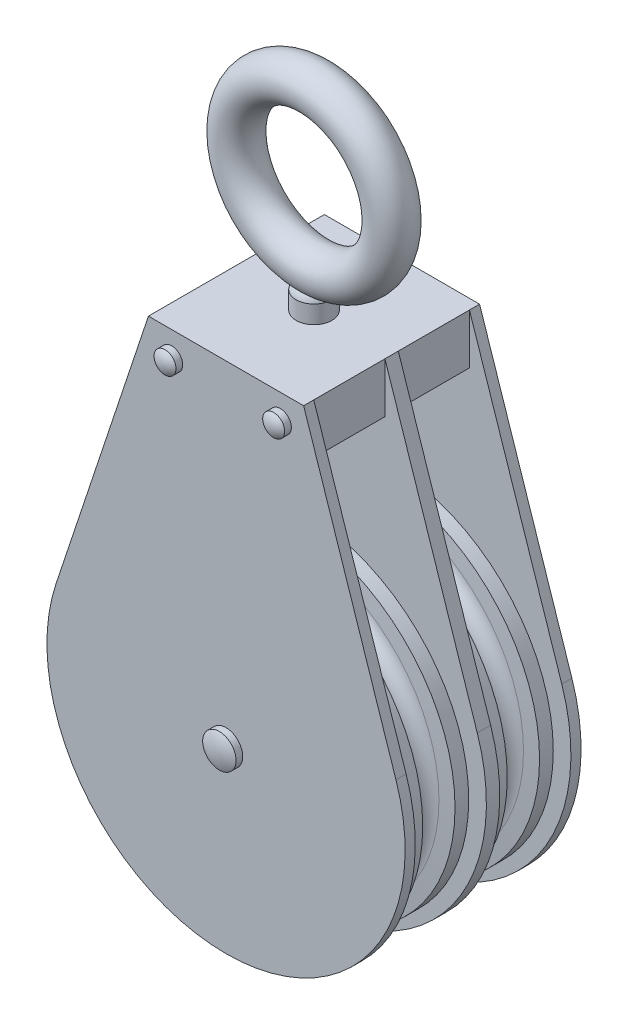
from build123d import *

# Parameters (mm, degrees)
BOSS_EXTRUDE1_DEPTH   = 2.6924
SKETCH5_W             = 41.275
SKETCH5_H             = 13.335
BOSS_EXTRUDE2_DEPTH   = 9.4615
SKETCH10_R            = 5.55625
SKETCH6_R             = 4.445
SKETCH6_R_2           = 2.921
BOSS_EXTRUDE3_DEPTH   = 1.778
DOME1_FACE_RADIUS     = 2.921
DOME1_HEIGHT          = 1.016
DOME3_FACE_RADIUS     = 2.921
DOME3_HEIGHT          = 1.016
DOME8_FACE_RADIUS     = 4.445
DOME8_HEIGHT          = 1.016
SKETCH8_R             = 4.191
BOSS_EXTRUDE4_DEPTH   = 1.778
BOSS_EXTRUDE4_2_DEPTH = 1.778
SKETCH8_R_2           = 6.35
BOSS_EXTRUDE4_3_DEPTH = 1.778
DOME5_FACE_RADIUS     = 4.191
DOME5_HEIGHT          = 2.54
DOME6_FACE_RADIUS     = 4.191
DOME6_HEIGHT          = 2.54
DOME7_FACE_RADIUS     = 6.35
DOME7_HEIGHT          = 3.9624
BOSS_EXTRUDE5_REACH   = 164.351
SKETCH9_R             = 3.57505
SKETCH15_R            = 4.7625
BOSS_EXTRUDE6_DEPTH   = 4.064
FILLET1_R             = 2.032


with BuildPart() as part:
    # Sketch3 → Revolve1 (revolve)
    with BuildSketch(Plane(origin=(0, 0, 0), x_dir=(0, 0, -1), z_dir=(1, 0, 0)), mode=Mode.PRIVATE) as revolve1_sk:
        with BuildLine():
            Line((-7.9375, 44.45), (-7.9375, 0))
            Line((-7.9375, 0), (7.9375, 0))
            Line((7.9375, 0), (7.9375, 44.45))
            Line((7.9375, 44.45), (4.297797433, 44.45))
            Line((4.297797433, 44.45), (3.953647708, 40.516350646))
            ThreePointArc((3.953647708, 40.516350646), (0, 36.8935), (-3.953647708, 40.516350646))
            Line((-3.953647708, 40.516350646), (-4.297797433, 44.45))
            Line((-4.297797433, 44.45), (-7.9375, 44.45))
        make_face()
    revolve(revolve1_sk.sketch.rotate(Axis((0, 0, 7.9375), (0, 0, -1)), 90), axis=Axis((0, 0, 7.9375), (0, 0, -1)))


with BuildPart() as body_2:
    # Sketch4 → Boss-Extrude1 (new body)
    with BuildSketch(Plane.XY.offset(9.4615)):
        with BuildLine():
            Line((-20.6375, 88.9), (20.6375, 88.9))
            Line((20.6375, 88.9), (45.193815989, 15.021971288))
            ThreePointArc((45.193815989, 15.021971288), (0, -47.625), (-45.193815989, 15.021971288))
            Line((-45.193815989, 15.021971288), (-20.6375, 88.9))
        make_face()
    extrude(amount=BOSS_EXTRUDE1_DEPTH)

    # Sketch5 → Boss-Extrude2 (add)
    with BuildSketch(Plane(origin=(0, 0, 9.4615), x_dir=(-1, 0, 0), z_dir=(0, 0, -1))):
        with Locations((0, 82.2325)):
            Rectangle(SKETCH5_W, SKETCH5_H)
    extrude(amount=BOSS_EXTRUDE2_DEPTH)

    # Mirror1: body 2 across plane


with BuildPart() as body_2_1:
    add(body_2.part)
    add(body_2.part.mirror(Plane.XY))


with BuildPart() as body_3:
    # Mirror8: mirrored copy
    add(part.part.mirror(Plane(origin=(0, 0, -11.2395), x_dir=(1, 0, 0), z_dir=(0, 0, -1))))


with BuildPart() as body_4:
    # Mirror8 2: mirrored copy
    add(body_2_1.part.mirror(Plane(origin=(0, 0, -11.2395), x_dir=(1, 0, 0), z_dir=(0, 0, -1))))


with BuildPart() as body_5:
    # Sweep2: sweep along a path in Sketch11
    with BuildLine(Plane.XY.offset(-11.2395)) as sweep2_path:
        ThreePointArc((20.6375, 119.85625), (0, 140.49375), (-20.6375, 119.85625))
    # Sketch10 → Sweep2 (sweep)
    with BuildSketch(Plane(origin=(0, 119.85625, 0), x_dir=(-1, 0, 0), z_dir=(0, 1, 0))):
        with Locations((-20.6375, -11.2395)):
            Circle(SKETCH10_R)
    sweep(path=sweep2_path.line)

    # Mirror7: body 5 across plane


with BuildPart() as body_5_1:
    add(body_5.part)
    add(body_5.part.mirror(Plane(origin=(20.6375, 119.85625, -11.2395), x_dir=(0, 0, 1), z_dir=(0, 1, 0))))

    # Sketch14 → Revolve2 (revolve)
    with BuildSketch(Plane.XY.offset(-11.2395), mode=Mode.PRIVATE) as revolve2_sk:
        with BuildLine():
            Line((4.7625, 88.9), (4.7625, 93.6625))
            ThreePointArc((4.7625, 93.6625), (3.016714146, 96.331608663), (0, 97.366666667))
            Line((0, 97.366666667), (0, 88.9))
            Line((0, 88.9), (4.7625, 88.9))
        make_face()
    revolve(revolve2_sk.sketch.rotate(Axis((0, 53.18125, -11.2395), (0, 1, 0)), 90), axis=Axis((0, 53.18125, -11.2395), (0, 1, 0)))


with BuildPart() as body_2_2:
    add(body_2_1.part)

    # Sketch6 → Boss-Extrude3 (add)
    with BuildSketch(Plane.XY.offset(12.1539)):
        Circle(SKETCH6_R)
        with Locations((-14.44625, 82.2325)):
            Circle(SKETCH6_R_2)
        with Locations((14.44625, 82.2325)):
            Circle(SKETCH6_R_2)
    extrude(amount=BOSS_EXTRUDE3_DEPTH)

    # Dome1: a dome of height H over a round flat face of radius A is a cap of a sphere of radius (A * A + H * H) / (2 * H)
    dome1_r = (DOME1_FACE_RADIUS * DOME1_FACE_RADIUS + DOME1_HEIGHT * DOME1_HEIGHT) / (2 * DOME1_HEIGHT)
    dome1_base = Plane((-14.44625, 82.2325, 13.9319), z_dir=(0, 0, 1))
    with Locations(dome1_base.offset(DOME1_HEIGHT - dome1_r)):
        dome1_ball = Sphere(dome1_r, mode=Mode.PRIVATE)
    add(split(dome1_ball, bisect_by=dome1_base, keep=Keep.TOP, mode=Mode.PRIVATE))

    # Dome3: a dome of height H over a round flat face of radius A is a cap of a sphere of radius (A * A + H * H) / (2 * H)
    dome3_r = (DOME3_FACE_RADIUS * DOME3_FACE_RADIUS + DOME3_HEIGHT * DOME3_HEIGHT) / (2 * DOME3_HEIGHT)
    dome3_base = Plane((14.44625, 82.2325, 13.9319), z_dir=(0, 0, 1))
    with Locations(dome3_base.offset(DOME3_HEIGHT - dome3_r)):
        dome3_ball = Sphere(dome3_r, mode=Mode.PRIVATE)
    add(split(dome3_ball, bisect_by=dome3_base, keep=Keep.TOP, mode=Mode.PRIVATE))

    # Dome8: a dome of height H over a round flat face of radius A is a cap of a sphere of radius (A * A + H * H) / (2 * H)
    dome8_r = (DOME8_FACE_RADIUS * DOME8_FACE_RADIUS + DOME8_HEIGHT * DOME8_HEIGHT) / (2 * DOME8_HEIGHT)
    dome8_base = Plane((0, 0, 13.9319), z_dir=(0, 0, 1))
    with Locations(dome8_base.offset(DOME8_HEIGHT - dome8_r)):
        dome8_ball = Sphere(dome8_r, mode=Mode.PRIVATE)
    add(split(dome8_ball, bisect_by=dome8_base, keep=Keep.TOP, mode=Mode.PRIVATE))


with BuildPart() as body_6:
    # Sketch8 → Boss-Extrude4 (new body)
    with BuildSketch(Plane(origin=(0, 0, -34.6329), x_dir=(-1, 0, 0), z_dir=(0, 0, -1))):
        with Locations((-14.44625, 82.2325)):
            Circle(SKETCH8_R)
    extrude(amount=BOSS_EXTRUDE4_DEPTH)

    # Dome5: a dome of height H over a round flat face of radius A is a cap of a sphere of radius (A * A + H * H) / (2 * H)
    dome5_r = (DOME5_FACE_RADIUS * DOME5_FACE_RADIUS + DOME5_HEIGHT * DOME5_HEIGHT) / (2 * DOME5_HEIGHT)
    dome5_base = Plane((14.44625, 82.2325, -36.4109), z_dir=(0, 0, -1))
    with Locations(dome5_base.offset(DOME5_HEIGHT - dome5_r)):
        dome5_ball = Sphere(dome5_r, mode=Mode.PRIVATE)
    add(split(dome5_ball, bisect_by=dome5_base, keep=Keep.TOP, mode=Mode.PRIVATE))


with BuildPart() as body_7:
    # Sketch8 → Boss-Extrude4 2 (new body)
    with BuildSketch(Plane(origin=(0, 0, -34.6329), x_dir=(-1, 0, 0), z_dir=(0, 0, -1))):
        with Locations((14.44625, 82.2325)):
            Circle(SKETCH8_R)
    extrude(amount=BOSS_EXTRUDE4_2_DEPTH)

    # Dome6: a dome of height H over a round flat face of radius A is a cap of a sphere of radius (A * A + H * H) / (2 * H)
    dome6_r = (DOME6_FACE_RADIUS * DOME6_FACE_RADIUS + DOME6_HEIGHT * DOME6_HEIGHT) / (2 * DOME6_HEIGHT)
    dome6_base = Plane((-14.44625, 82.2325, -36.4109), z_dir=(0, 0, -1))
    with Locations(dome6_base.offset(DOME6_HEIGHT - dome6_r)):
        dome6_ball = Sphere(dome6_r, mode=Mode.PRIVATE)
    add(split(dome6_ball, bisect_by=dome6_base, keep=Keep.TOP, mode=Mode.PRIVATE))


with BuildPart() as body_8:
    # Sketch8 → Boss-Extrude4 3 (new body)
    with BuildSketch(Plane(origin=(0, 0, -34.6329), x_dir=(-1, 0, 0), z_dir=(0, 0, -1))):
        Circle(SKETCH8_R_2)
    extrude(amount=BOSS_EXTRUDE4_3_DEPTH)

    # Dome7: a dome of height H over a round flat face of radius A is a cap of a sphere of radius (A * A + H * H) / (2 * H)
    dome7_r = (DOME7_FACE_RADIUS * DOME7_FACE_RADIUS + DOME7_HEIGHT * DOME7_HEIGHT) / (2 * DOME7_HEIGHT)
    dome7_base = Plane((0, 0, -36.4109), z_dir=(0, 0, -1))
    with Locations(dome7_base.offset(DOME7_HEIGHT - dome7_r)):
        dome7_ball = Sphere(dome7_r, mode=Mode.PRIVATE)
    add(split(dome7_ball, bisect_by=dome7_base, keep=Keep.TOP, mode=Mode.PRIVATE))


with BuildPart() as part_1:
    add(part.part)

    # Boss-Extrude5: up to this face of the body (flat: up to its plane)
    boss_extrude5_end = Plane(body_4.part.faces().sort_by_distance((0, 17.170238389, -34.6329))[0])
    # Sketch9 → Boss-Extrude5 (add, up to the picked face)
    with BuildSketch(Plane.XY.offset(12.1539), mode=Mode.PRIVATE) as boss_extrude5_sk1:
        Circle(SKETCH9_R)
    boss_extrude5_tool1 = split(extrude(boss_extrude5_sk1.sketch, amount=-BOSS_EXTRUDE5_REACH, mode=Mode.PRIVATE), bisect_by=boss_extrude5_end, keep=Keep.BOTH, mode=Mode.PRIVATE)

    add(body_2_2.part)  # Boss-Extrude5 merges body 2
    add(boss_extrude5_tool1.solids().sort_by(Axis((0, 0, 12.1539), (0, 0, -1)))[0])

    # Combine1: union body 5
    add(body_5_1.part)

    # Sketch15 → Boss-Extrude6 (add)
    with BuildSketch(Plane.XZ.offset(-75.565)):
        with Locations(Location((0, -11.2395, 0), (0, 0, 270))):
            Circle(SKETCH15_R)
    extrude(amount=BOSS_EXTRUDE6_DEPTH)

    # Fillet1
    fillet1_edges = [part_1.edges().sort_by_distance(p)[0] for p in [
        (0, 71.501, -6.477),
        (0, 71.501, -16.002),
    ]]
    fillet(fillet1_edges, radius=FILLET1_R)


with BuildPart() as body_3_1:
    add(body_3.part)

    # Combine2: union body 6, body 4, body 7, part, body 8
    add(body_6.part)
    add(body_4.part)
    add(body_7.part)
    add(part_1.part)
    add(body_8.part)


solid = body_3_1.part
